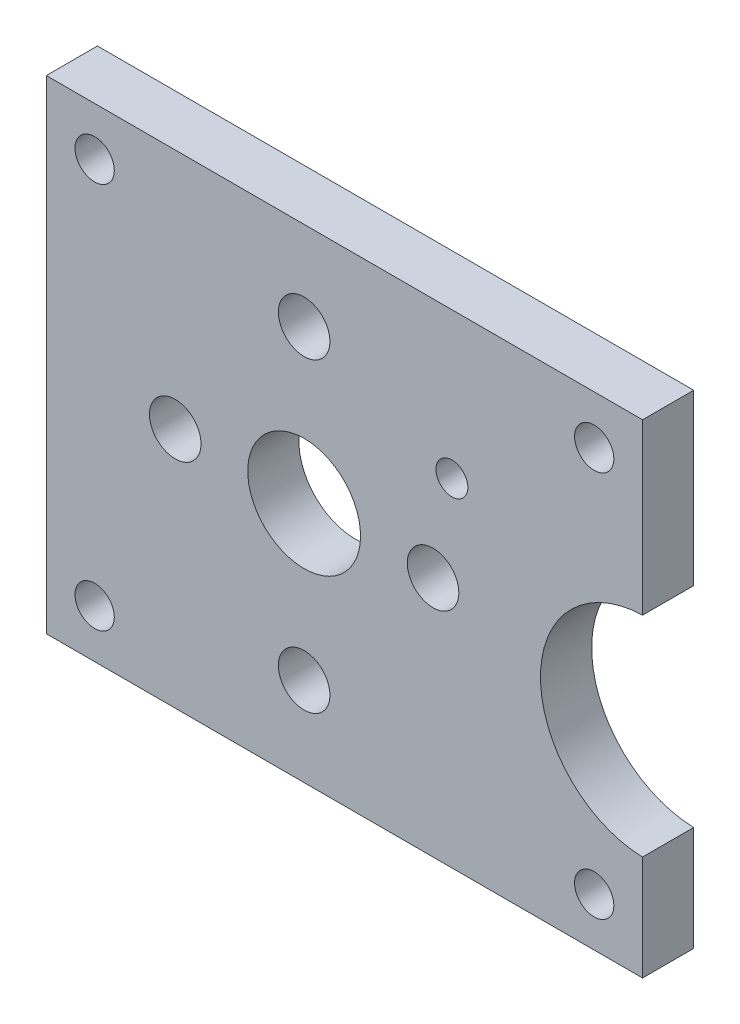
from build123d import *

# Parameters (mm, degrees)
SKETCH1_R                 = 0.9906
SKETCH1_R_2               = 1.6
SKETCH1_R_3               = 3.5
BOSS_EXTRUDE2_DEPTH       = 3.175
F_2_CLEARANCE_HOLE1_D     = 2.4384
F_2_CLEARANCE_HOLE1_DEPTH = 3.302
F_2_CLEARANCE_HOLE1_TIP   = 0.732569267


with BuildPart() as part:
    # Sketch1 → Boss-Extrude2 (new body)
    with BuildSketch(Plane.XY):
        with BuildLine():
            Line((0, 0), (37, 0))
            Line((37, 0), (37, 6.50213794))
            ThreePointArc((37, 6.50213794), (30.666699296, 13), (37, 19.49786206))
            Line((37, 19.49786206), (37, 30))
            Line((37, 30), (0, 30))
            Line((0, 30), (0, 0))
        make_face()
        with Locations((25.169778966, 20.933400182)):
            Circle(SKETCH1_R, mode=Mode.SUBTRACT)
        with Locations((16, 24.5)):
            Circle(SKETCH1_R_2, mode=Mode.SUBTRACT)
        with Locations((24, 15)):
            Circle(SKETCH1_R_2, mode=Mode.SUBTRACT)
        with Locations(Location((16, 5.5, 0), (0, 0, 180))):
            Circle(SKETCH1_R_2, mode=Mode.SUBTRACT)
        with Locations(Location((8, 15, 0), (0, 0, 180))):
            Circle(SKETCH1_R_2, mode=Mode.SUBTRACT)
        with Locations((16, 15)):
            Circle(SKETCH1_R_3, mode=Mode.SUBTRACT)
    extrude(amount=BOSS_EXTRUDE2_DEPTH)

    # #2 Clearance Hole1
    with Locations(Plane.XY.offset(3.175)):
        with Locations((3, 27), (3, 3), (34, 3), (34, 27)):
            Hole(F_2_CLEARANCE_HOLE1_D / 2, depth=F_2_CLEARANCE_HOLE1_DEPTH)
            with Locations((0, 0, -(F_2_CLEARANCE_HOLE1_DEPTH + F_2_CLEARANCE_HOLE1_TIP / 2))):  # 118° drill point
                Cone(0, F_2_CLEARANCE_HOLE1_D / 2, F_2_CLEARANCE_HOLE1_TIP, mode=Mode.SUBTRACT)


solid = part.part
